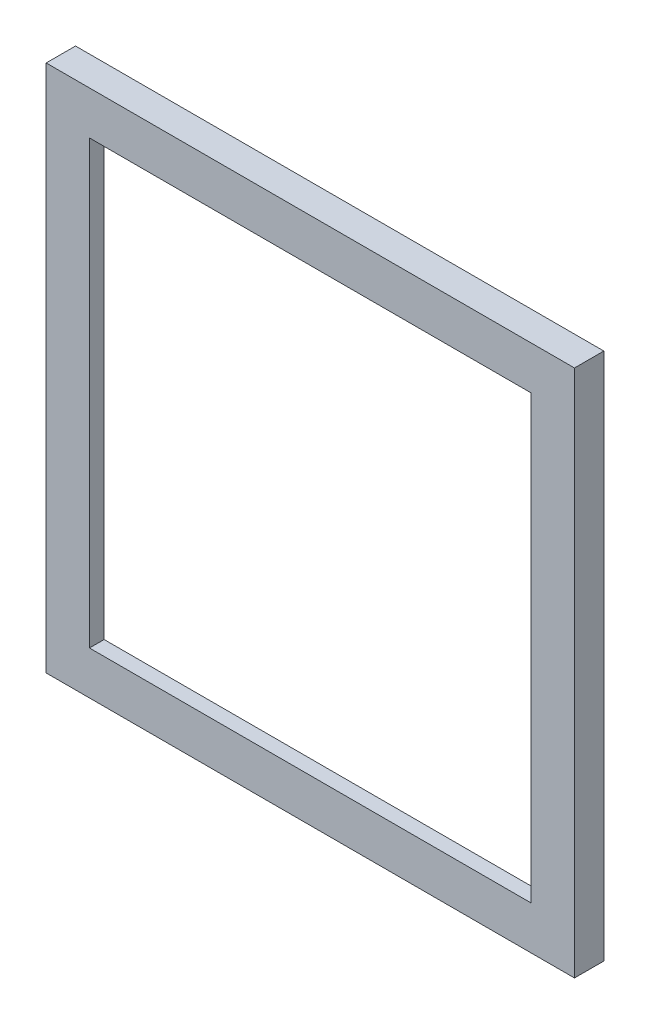
from build123d import *

# Parameters (mm, degrees)
ESQUISSE1_W             = 36
ESQUISSE1_H             = 36
ESQUISSE1_W_2           = 30.1
ESQUISSE1_H_2           = 30.1
BOSS_EXTRU_1_DEPTH      = 2
ESQUISSE2_W             = 34
ESQUISSE2_H             = 34
ENL_V_MAT_EXTRU_1_DEPTH = 1


with BuildPart() as part:
    # Esquisse1 → Boss.-Extru.1 (new body)
    with BuildSketch(Plane.XY):
        Rectangle(ESQUISSE1_W, ESQUISSE1_H)
        Rectangle(ESQUISSE1_W_2, ESQUISSE1_H_2, mode=Mode.SUBTRACT)
    extrude(amount=BOSS_EXTRU_1_DEPTH)

    # Esquisse2 → Enlèv. mat.-Extru.1 (cut)
    with BuildSketch(Plane(origin=(0, 0, 0), x_dir=(-1, 0, 0), z_dir=(0, 0, -1))):
        Rectangle(ESQUISSE2_W, ESQUISSE2_H)
    extrude(amount=-ENL_V_MAT_EXTRU_1_DEPTH, mode=Mode.SUBTRACT)


solid = part.part
